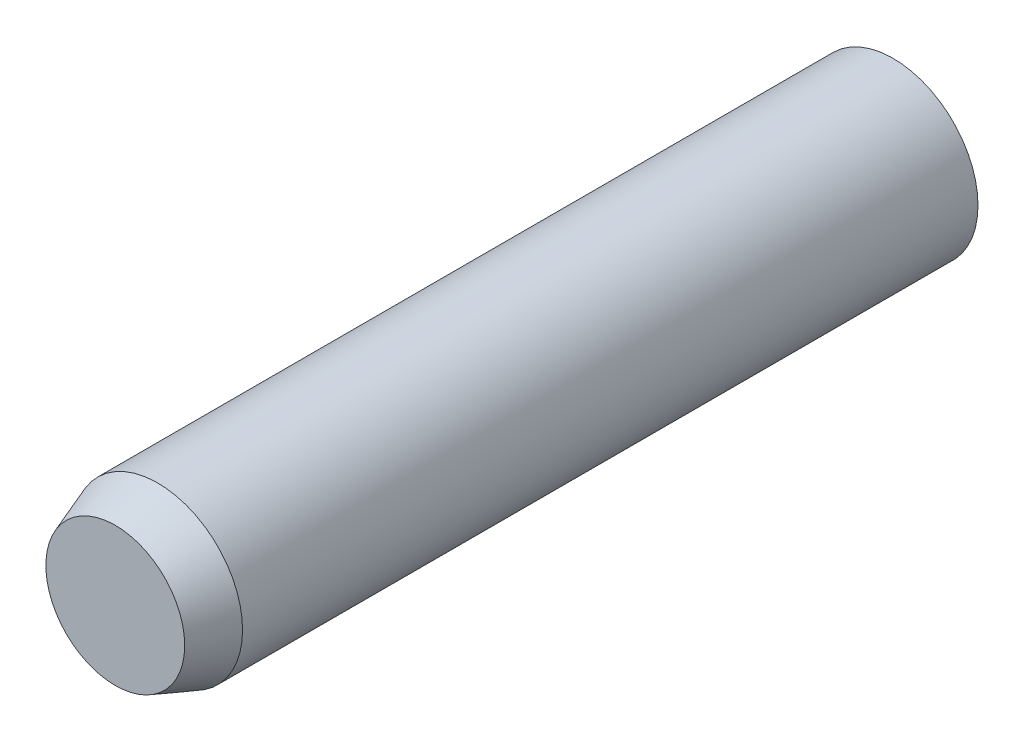
from build123d import *

# Parameters (mm, degrees)
SKETCH1_R           = 6
BOSS_EXTRUDE1_DEPTH = 55
CHAMFER1_SIZE       = 3
CHAMFER1_SIZE2      = 1.091910703


with BuildPart() as part:
    # Sketch1 → Boss-Extrude1 (new body)
    with BuildSketch(Plane.XY):
        Circle(SKETCH1_R)
    extrude(amount=BOSS_EXTRUDE1_DEPTH)

    # Chamfer1
    chamfer1_edges = [part.edges().sort_by_distance(p)[0] for p in [
        (-6, 0, 55),
    ]]
    chamfer1_side = [part.faces().sort_by_distance(p)[0] for p in [
        (-6, 0, 27.5),
    ]]
    chamfer(chamfer1_edges, length=CHAMFER1_SIZE, length2=CHAMFER1_SIZE2, reference=chamfer1_side[0])


solid = part.part
